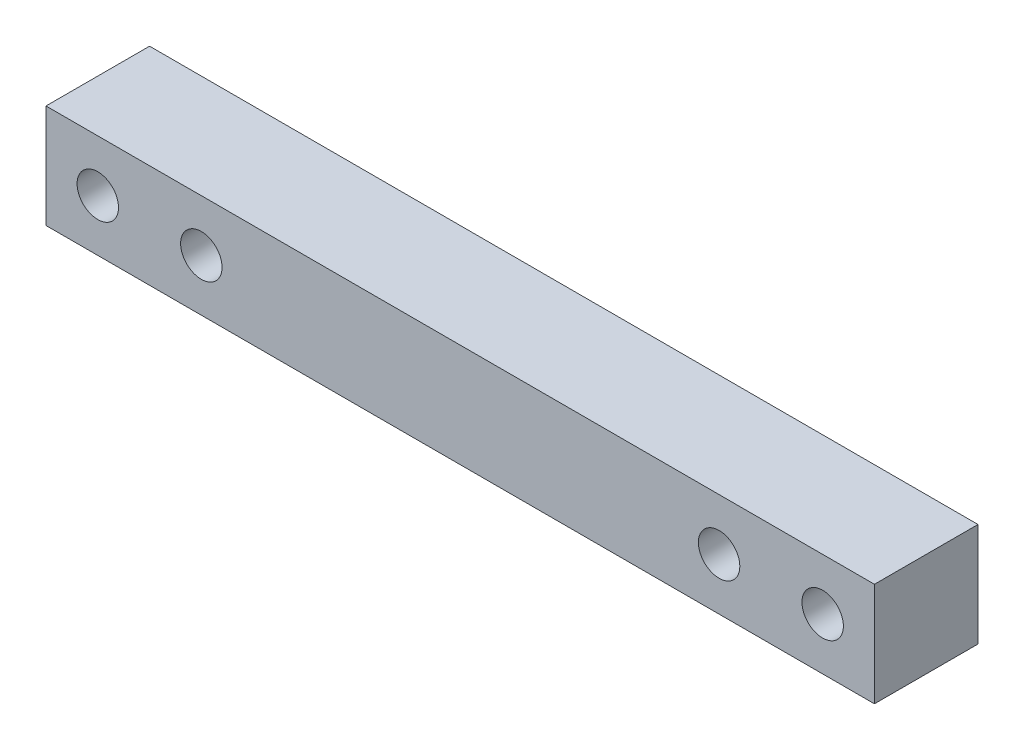
from build123d import *

# Parameters (mm, degrees)
SKETCH_1_W          = 80
SKETCH_1_H          = 10
EXTRUDE_1_DEPTH     = 10
SKETCH_2_R          = 2
CUT_EXTRUDE_1_DEPTH = 10


with BuildPart() as part:
    # 草图1 → 凸台-拉伸1 (new body)
    with BuildSketch(Plane.XY):
        Rectangle(SKETCH_1_W, SKETCH_1_H)
    extrude(amount=EXTRUDE_1_DEPTH)

    # 草图2 → 切除-拉伸1 (cut)
    with BuildSketch(Plane.XY.offset(10)):
        with Locations((-35, 0)):
            Circle(SKETCH_2_R)
        with Locations((35, 0)):
            Circle(SKETCH_2_R)
        with Locations((-25, 0)):
            Circle(SKETCH_2_R)
        with Locations((25, 0)):
            Circle(SKETCH_2_R)
    extrude(amount=-CUT_EXTRUDE_1_DEPTH, mode=Mode.SUBTRACT)


solid = part.part
